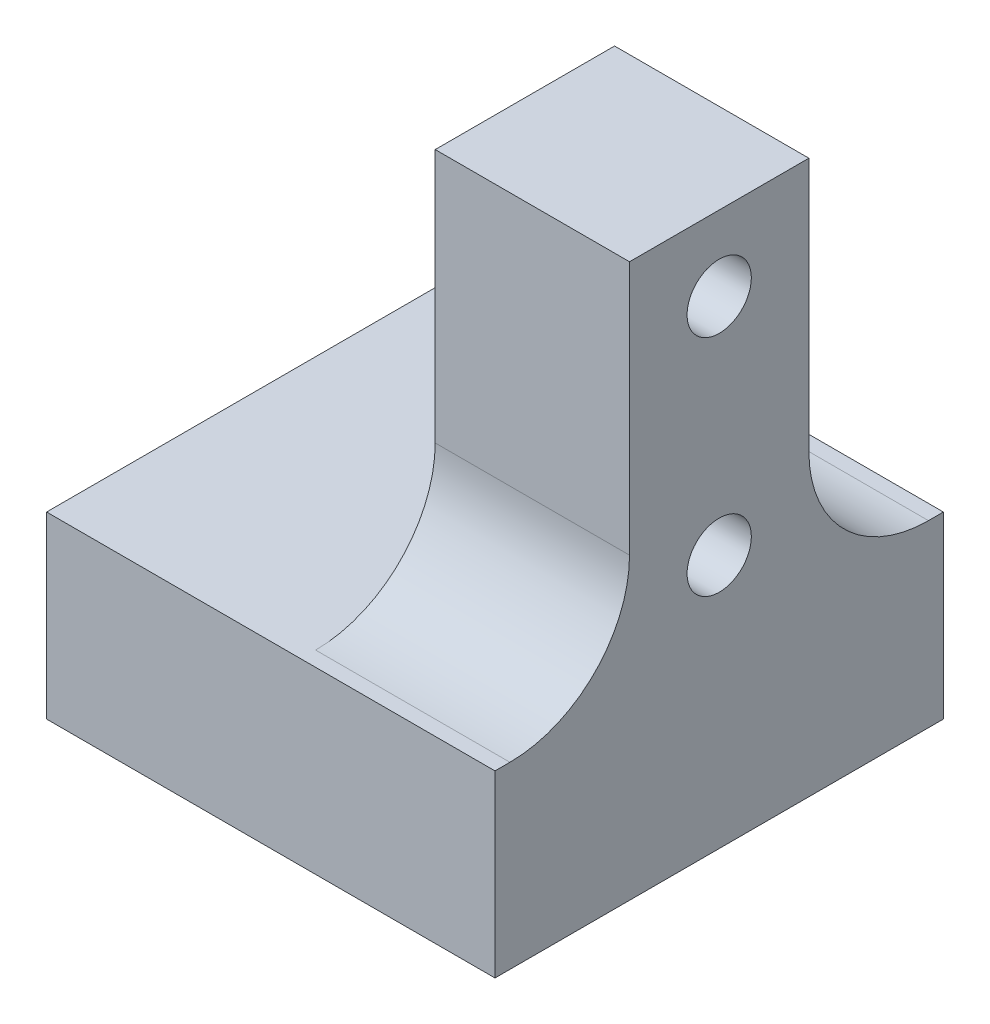
from build123d import *

# Parameters (mm, degrees)
SKETCH1_W           = 30
SKETCH1_H           = 30
BOSS_EXTRUDE1_DEPTH = 12
SKETCH2_W           = 5
SKETCH2_H           = 12
SKETCH2_W_2         = 8
BOSS_EXTRUDE2_DEPTH = 25
FILLET1_R           = 8
SKETCH3_R           = 2.15
CUT_EXTRUDE1_DEPTH  = 50.939963957


with BuildPart() as part:
    # Sketch1 → Boss-Extrude1 (new body)
    with BuildSketch(Plane(origin=(0, 0, 0), x_dir=(1, 0, 0), z_dir=(0, 1, 0))):
        Rectangle(SKETCH1_W, SKETCH1_H)
    extrude(amount=BOSS_EXTRUDE1_DEPTH)

    # Sketch2 → Boss-Extrude2 (add)
    with BuildSketch(Plane(origin=(0, 12, 0), x_dir=(1, 0, 0), z_dir=(0, 1, 0))):
        with Locations((12.5, 0)):
            Rectangle(SKETCH2_W, SKETCH2_H)
        with Locations((6, 0)):
            Rectangle(SKETCH2_W_2, SKETCH2_H)
    extrude(amount=BOSS_EXTRUDE2_DEPTH)

    # Fillet1
    fillet1_edges = [part.edges().sort_by_distance(p)[0] for p in [
        (8.5, 12, -6),
        (8.5, 12, 6),
    ]]
    fillet(fillet1_edges, radius=FILLET1_R)

    # Sketch3 → Cut-Extrude1 (cut, through all)
    with BuildSketch(Plane(origin=(15, 0, 0), x_dir=(0, 0, -1), z_dir=(1, 0, 0))):
        with Locations((0, 17)):
            Circle(SKETCH3_R)
        with Locations((0, 32)):
            Circle(SKETCH3_R)
    extrude(amount=-CUT_EXTRUDE1_DEPTH, mode=Mode.SUBTRACT)


solid = part.part
